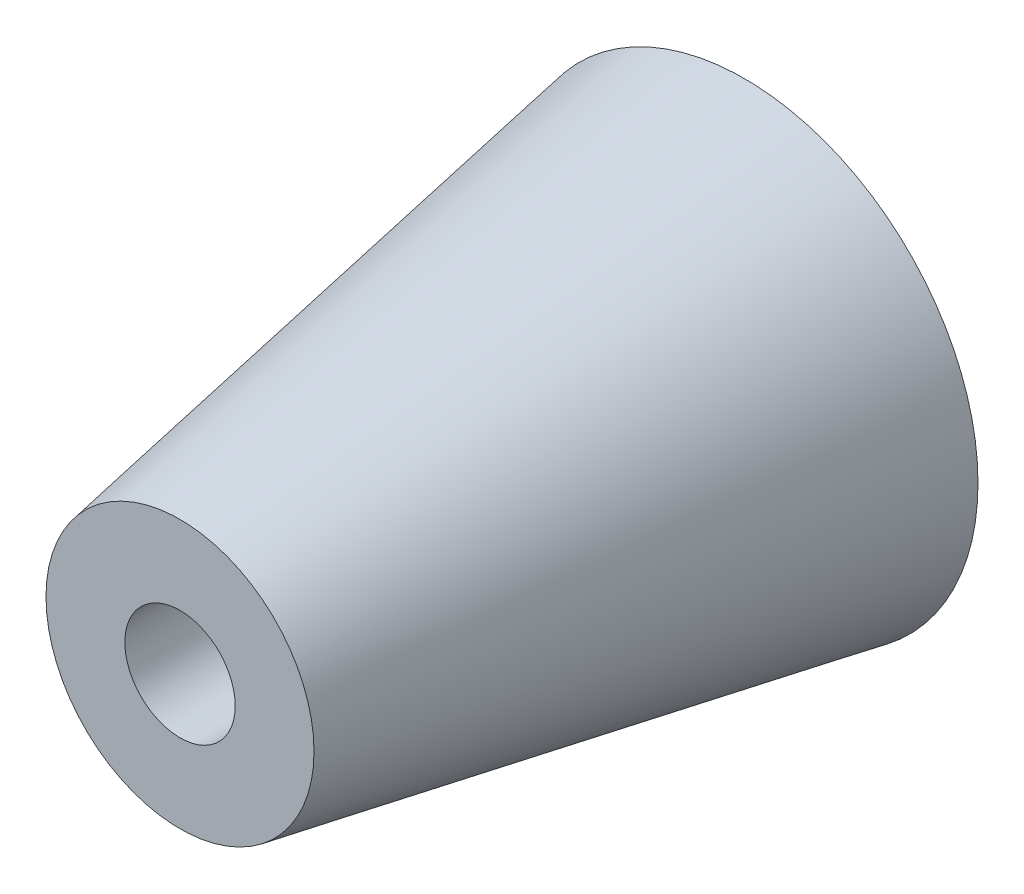
from build123d import *


with BuildPart() as part:
    # Sketch1 → Revolve1 (revolve)
    with BuildSketch(Plane(origin=(0, 0, 0), x_dir=(0, 0, -1), z_dir=(1, 0, 0)), mode=Mode.PRIVATE) as revolve1_sk:
        Polygon((-33.715360463, 3.5), (-28.715360463, 3.5), (2.084639537, 9.462981285), (2.084639537, 14.812505909), (-33.715360463, 8.5), align=None)
    revolve(revolve1_sk.sketch.rotate(Axis((0, 0, 51.495497957), (0, 0, -1)), 90), axis=Axis((0, 0, 51.495497957), (0, 0, -1)))


solid = part.part
